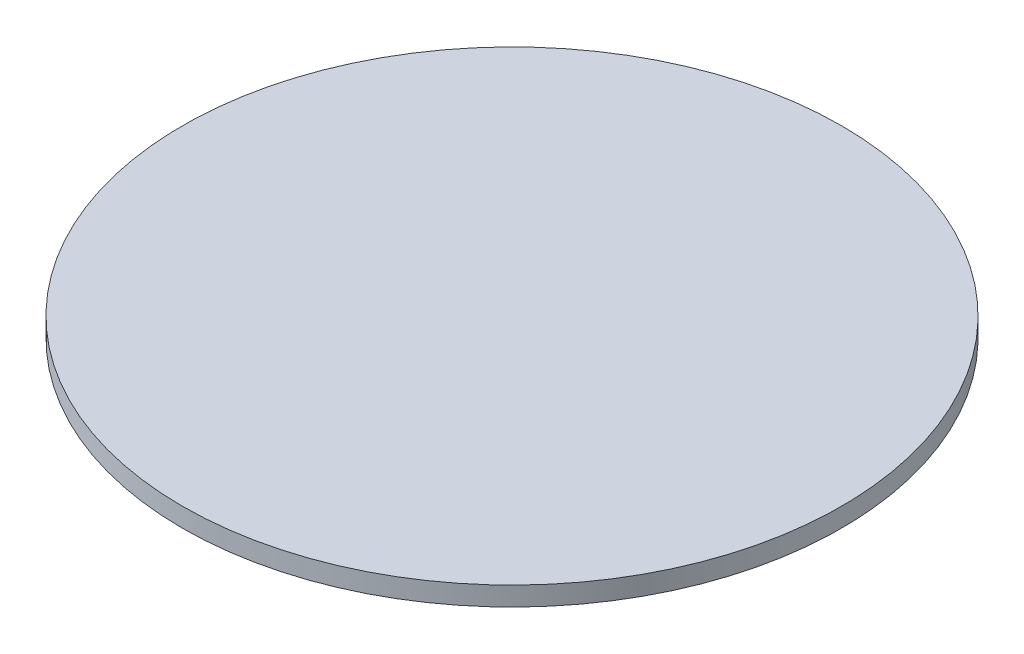
from build123d import *

# Parameters (mm, degrees)
SKETCH1_R           = 43.950602128
BOSS_EXTRUDE1_DEPTH = 2.54


with BuildPart() as part:
    # Sketch1 → Boss-Extrude1 (new body)
    with BuildSketch(Plane(origin=(0, 0, 0), x_dir=(1, 0, 0), z_dir=(0, 1, 0))):
        with Locations(Location((0, 0, 0), (0, 0, 270))):
            Circle(SKETCH1_R)
    extrude(amount=BOSS_EXTRUDE1_DEPTH)


solid = part.part
